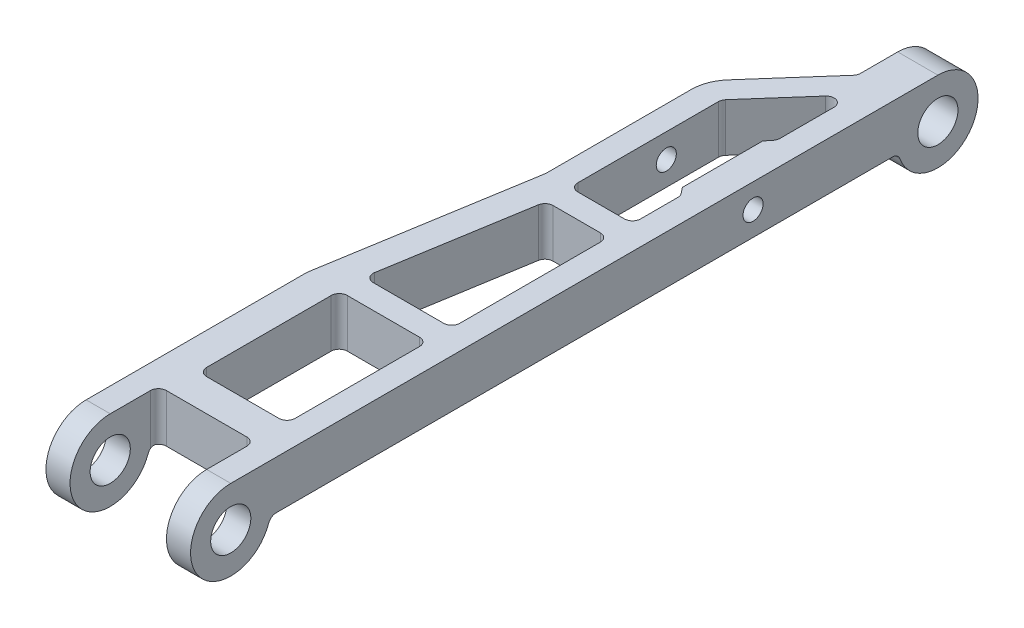
from build123d import *

# Parameters (mm, degrees)
SKETCH_1_W               = 7
SKETCH_1_H               = 10
EXTRUDE_1_DEPTH          = 5
SKETCH_5_W               = 11
SKETCH_5_H               = 17.5
CUT_EXTRUDE_3_DEPTH      = 97.484454706
HOLE_WIZARD_M3_1_D       = 2.5
CUT_EXTRUDE_1_DEPTH      = 97.095005073
CUT_EXTRUDE_1_DEPTH_BACK = 97.095005073
SKETCH_2_R               = 2.5
FILLET_1_R               = 1
FILLET_2_R               = 5


with BuildPart() as part:
    # 草图1 → 凸台-拉伸1 (new, symmetric)
    with BuildSketch(Plane(origin=(0, 0, 0), x_dir=(1, 0, 0), z_dir=(0, 1, 0))):
        Polygon((-22.5, 87), (-27.5, 87), (-27.5, 77), (-36.3, 67), (-36.3, 47), (-40.5, 21.5), (-40.5, -11), (-37.5, -11), (-37.5, 0), (-25.5, 0), (-25.5, -11), (-22.5, -11), align=None)
        with Locations((-29.8, 59)):
            Rectangle(SKETCH_1_W, SKETCH_1_H, mode=Mode.SUBTRACT)
    extrude(amount=EXTRUDE_1_DEPTH, both=True)

    # 草图5 → 切除-拉伸3 (cut, through all)
    with BuildSketch(Plane(origin=(0, 5, 0), x_dir=(1, 0, 0), z_dir=(0, 1, 0))):
        with BuildLine():
            Line((-25.5, 72.081517889), (-25.5, 65))
            Line((-25.5, 65), (-26.3, 64))
            Line((-26.3, 64), (-33.3, 64))
            Line((-33.3, 64), (-33.3, 65.867956599))
            Line((-33.3, 65.867956599), (-27.250713517, 72.742145784))
            ThreePointArc((-27.250713517, 72.742145784), (-26.146951503, 73.017122912), (-25.5, 72.081517889))
        make_face()
        Polygon((-25.5, 53), (-25.5, 47), (-33.3, 47), (-33.3, 54), (-26.3, 54), align=None)
        with Locations((-31, 12.75)):
            Rectangle(SKETCH_5_W, SKETCH_5_H)
        Polygon((-36.458725979, 24.5), (-33.246961273, 44), (-25.5, 44), (-25.5, 24.5), align=None)
    extrude(amount=-CUT_EXTRUDE_3_DEPTH, mode=Mode.SUBTRACT)

    # M3 螺纹孔1 (through all)
    with Locations(Plane.ZY.offset(36.3)):
        with Locations((-59, 2)):
            Hole(HOLE_WIZARD_M3_1_D / 2)

    # 草图2 → 切除-拉伸1 (cut, two sides: drawn at the far end of the back side and taken through both)
    with BuildSketch(Plane(origin=(0, 0, 0), x_dir=(0, 0, -1), z_dir=(1, 0, 0)).offset(-CUT_EXTRUDE_1_DEPTH_BACK)):
        with Locations((-6, 0)):
            Circle(SKETCH_2_R)
        with Locations((82, 0)):
            Circle(SKETCH_2_R)
        with BuildLine():
            Line((82, 5), (88, 5))
            Line((88, 5), (88, -6))
            Line((88, -6), (-12, -6))
            Line((-12, -6), (-12, 5))
            Line((-12, 5), (-6, 5))
            ThreePointArc((-6, 5), (-10.082482905, -2.886751346), (-1.285954792, -1.666666667))
            ThreePointArc((-1.285954792, -1.666666667), (-0.92049602, -1.183503419), (-0.343145751, -1))
            Line((-0.343145751, -1), (76.343145751, -1))
            ThreePointArc((76.343145751, -1), (76.92049602, -1.183503419), (77.285954792, -1.666666667))
            ThreePointArc((77.285954792, -1.666666667), (86.082482905, -2.886751346), (82, 5))
        make_face()
    extrude(amount=CUT_EXTRUDE_1_DEPTH + CUT_EXTRUDE_1_DEPTH_BACK, mode=Mode.SUBTRACT)

    # 圆角1
    fillet_1_edges = [part.edges().sort_by_distance(p)[0] for p in [
        (-37.5, 2, 0),
        (-36.5, 2, -21.5),
        (-36.5, 2, -4),
        (-25.5, 2, -4),
        (-25.5, 2, -21.5),
        (-25.5, 2, -24.5),
        (-36.458725979, 2, -24.5),
        (-33.246961273, 2, -44),
        (-25.5, 2, -44),
        (-33.3, 2, -65.867956599),
        (-33.3, 2, -47),
        (-25.5, 2, -47),
        (-25.5, 2, -53),
        (-25.5, 2, -65),
        (-27.5, 1.877008785, -77),
        (-25.5, 2, 0),
    ]]
    fillet(fillet_1_edges, radius=FILLET_1_R)

    # 圆角2
    fillet_2_edges = [part.edges().sort_by_distance(p)[0] for p in [
        (-40.5, 2, -21.5),
        (-36.3, 2, -47),
        (-36.3, 2, -67),
    ]]
    fillet(fillet_2_edges, radius=FILLET_2_R)


solid = part.part
